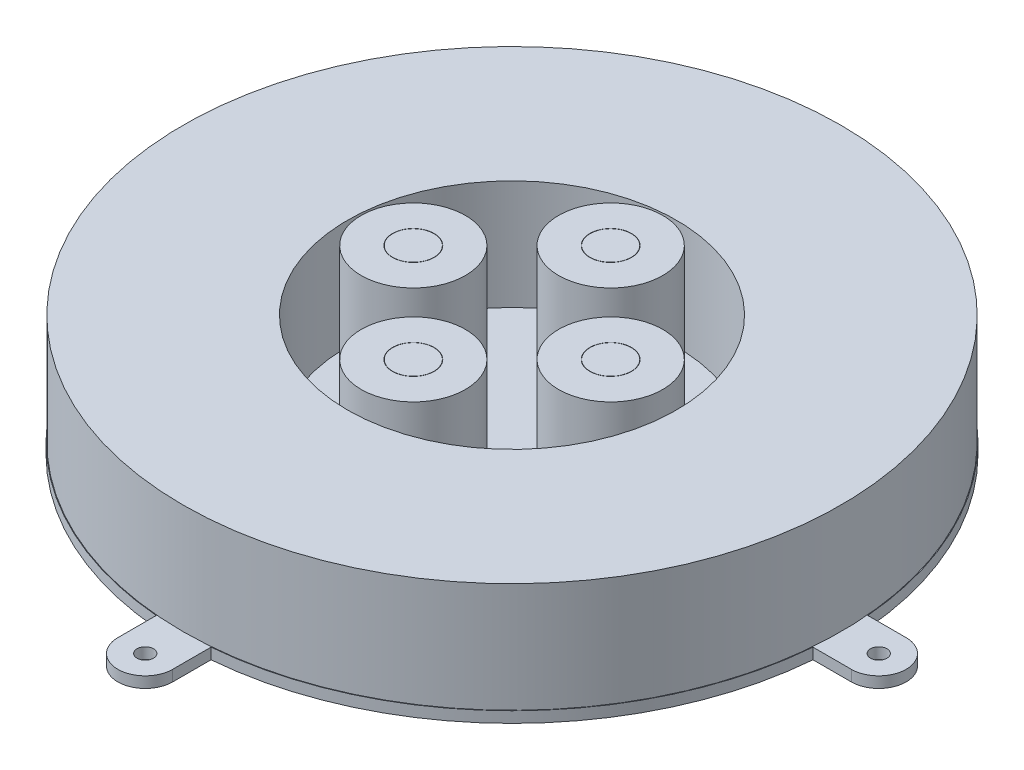
from build123d import *

# Parameters (mm, degrees)
SKETCH1_R             = 60
SKETCH1_R_2           = 30
BOSS_EXTRUDE1_DEPTH   = 10
SKETCH2_R             = 1.5
BOSS_EXTRUDE2_DEPTH   = 2
SKETCH3_R             = 9.5
SKETCH3_R_2           = 3.8
BOSS_EXTRUDE3_DEPTH   = 22
BOSS_EXTRUDE3_2_DEPTH = 22
SKETCH3_R_3           = 3.75
BOSS_EXTRUDE3_3_DEPTH = 22
BOSS_EXTRUDE3_4_DEPTH = 22
BOSS_EXTRUDE3_5_DEPTH = 22
BOSS_EXTRUDE3_6_DEPTH = 22
BOSS_EXTRUDE3_7_DEPTH = 22
BOSS_EXTRUDE3_8_DEPTH = 22


with BuildPart() as part:
    # Sketch1 → Boss-Extrude1 (new, symmetric)
    with BuildSketch(Plane(origin=(0, 0, 0), x_dir=(1, 0, 0), z_dir=(0, 1, 0))):
        with Locations(Location((0, 0, 0), (0, 0, 270))):
            Circle(SKETCH1_R)
        with Locations(Location((0, 0, 0), (0, 0, 270))):
            Circle(SKETCH1_R_2, mode=Mode.SUBTRACT)
    extrude(amount=BOSS_EXTRUDE1_DEPTH, both=True)


with BuildPart() as body_2:
    # Sketch2 → Boss-Extrude2 (new body)
    with BuildSketch(Plane.XZ.offset(10)):
        with BuildLine():
            Line((-5, 66.891652173), (-5, 59.891652173))
            ThreePointArc((-5, 59.891652173), (-42.497117549, 42.497117549), (-59.891652173, 5))
            Line((-59.891652173, 5), (-66.891652173, 5))
            ThreePointArc((-66.891652173, 5), (-71.891652173, 0), (-66.891652173, -5))
            Line((-66.891652173, -5), (-59.891652173, -5))
            ThreePointArc((-59.891652173, -5), (-42.497117549, -42.497117549), (-5, -59.891652173))
            Line((-5, -59.891652173), (-5, -66.891652173))
            ThreePointArc((-5, -66.891652173), (0, -71.891652173), (5, -66.891652173))
            Line((5, -66.891652173), (5, -59.891652173))
            ThreePointArc((5, -59.891652173), (42.497117549, -42.497117549), (59.891652173, -5))
            Line((59.891652173, -5), (66.891652173, -5))
            ThreePointArc((66.891652173, -5), (71.891652173, 0), (66.891652173, 5))
            Line((66.891652173, 5), (59.891652173, 5))
            ThreePointArc((59.891652173, 5), (42.497117549, 42.497117549), (5, 59.891652173))
            Line((5, 59.891652173), (5, 66.891652173))
            ThreePointArc((5, 66.891652173), (0, 71.891652173), (-5, 66.891652173))
        make_face()
        with Locations(Location((0, 66.891652173, 0), (0, 0, 270))):
            Circle(SKETCH2_R, mode=Mode.SUBTRACT)
        with Locations(Location((66.891652173, 0, 0), (0, 0, 270))):
            Circle(SKETCH2_R, mode=Mode.SUBTRACT)
        with Locations(Location((0, -66.891652173, 0), (0, 0, 270))):
            Circle(SKETCH2_R, mode=Mode.SUBTRACT)
        with Locations(Location((-66.891652173, 0, 0), (0, 0, 270))):
            Circle(SKETCH2_R, mode=Mode.SUBTRACT)
    extrude(amount=BOSS_EXTRUDE2_DEPTH)


with BuildPart() as body_3:
    # Sketch3 → Boss-Extrude3 (new body)
    with BuildSketch(Plane(origin=(0, -10, 0), x_dir=(1, 0, 0), z_dir=(0, 1, 0))):
        with Locations(Location((0, 18, 0), (0, 0, 270))):
            Circle(SKETCH3_R)
        with Locations(Location((0, 18, 0), (0, 0, 270))):
            Circle(SKETCH3_R_2, mode=Mode.SUBTRACT)
    extrude(amount=BOSS_EXTRUDE3_DEPTH)


with BuildPart() as body_4:
    # Sketch3 → Boss-Extrude3 2 (new body)
    with BuildSketch(Plane(origin=(0, -10, 0), x_dir=(1, 0, 0), z_dir=(0, 1, 0))):
        with Locations(Location((-18, 0, 0), (0, 0, 270))):
            Circle(SKETCH3_R)
        with Locations(Location((-18, 0, 0), (0, 0, 270))):
            Circle(SKETCH3_R_2, mode=Mode.SUBTRACT)
    extrude(amount=BOSS_EXTRUDE3_2_DEPTH)


with BuildPart() as body_5:
    # Sketch3 → Boss-Extrude3 3 (new body)
    with BuildSketch(Plane(origin=(0, -10, 0), x_dir=(1, 0, 0), z_dir=(0, 1, 0))):
        with Locations(Location((-18, 0, 0), (0, 0, 270))):
            Circle(SKETCH3_R_3)
    extrude(amount=BOSS_EXTRUDE3_3_DEPTH)


with BuildPart() as body_6:
    # Sketch3 → Boss-Extrude3 4 (new body)
    with BuildSketch(Plane(origin=(0, -10, 0), x_dir=(1, 0, 0), z_dir=(0, 1, 0))):
        with Locations(Location((0, -18, 0), (0, 0, 270))):
            Circle(SKETCH3_R)
        with Locations(Location((0, -18, 0), (0, 0, 270))):
            Circle(SKETCH3_R_2, mode=Mode.SUBTRACT)
    extrude(amount=BOSS_EXTRUDE3_4_DEPTH)


with BuildPart() as body_7:
    # Sketch3 → Boss-Extrude3 5 (new body)
    with BuildSketch(Plane(origin=(0, -10, 0), x_dir=(1, 0, 0), z_dir=(0, 1, 0))):
        with Locations(Location((0, -18, 0), (0, 0, 270))):
            Circle(SKETCH3_R_3)
    extrude(amount=BOSS_EXTRUDE3_5_DEPTH)


with BuildPart() as body_8:
    # Sketch3 → Boss-Extrude3 6 (new body)
    with BuildSketch(Plane(origin=(0, -10, 0), x_dir=(1, 0, 0), z_dir=(0, 1, 0))):
        with Locations(Location((18, 0, 0), (0, 0, 270))):
            Circle(SKETCH3_R_3)
    extrude(amount=BOSS_EXTRUDE3_6_DEPTH)


with BuildPart() as body_9:
    # Sketch3 → Boss-Extrude3 7 (new body)
    with BuildSketch(Plane(origin=(0, -10, 0), x_dir=(1, 0, 0), z_dir=(0, 1, 0))):
        with Locations(Location((18, 0, 0), (0, 0, 270))):
            Circle(SKETCH3_R)
        with Locations(Location((18, 0, 0), (0, 0, 270))):
            Circle(SKETCH3_R_2, mode=Mode.SUBTRACT)
    extrude(amount=BOSS_EXTRUDE3_7_DEPTH)


with BuildPart() as body_10:
    # Sketch3 → Boss-Extrude3 8 (new body)
    with BuildSketch(Plane(origin=(0, -10, 0), x_dir=(1, 0, 0), z_dir=(0, 1, 0))):
        with Locations(Location((0, 18, 0), (0, 0, 270))):
            Circle(SKETCH3_R_3)
    extrude(amount=BOSS_EXTRUDE3_8_DEPTH)


solid = Compound([part.part, body_2.part, body_3.part, body_4.part, body_5.part, body_6.part, body_7.part, body_8.part, body_9.part, body_10.part])
